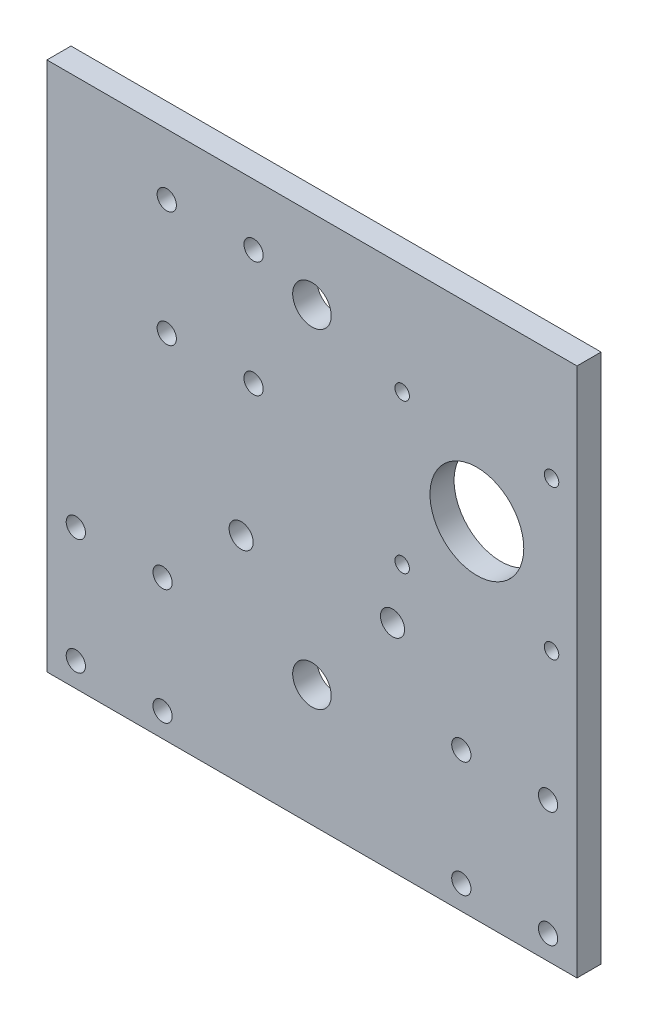
from build123d import *

# Parameters (mm, degrees)
SKETCH1_W           = 110
SKETCH1_H           = 110
SKETCH1_R           = 2
SKETCH1_R_2         = 9.730805131
SKETCH1_R_3         = 1.5
SKETCH1_R_4         = 4
SKETCH1_R_5         = 2.5
BOSS_EXTRUDE1_DEPTH = 5


with BuildPart() as part:
    # Sketch1 → Boss-Extrude1 (new body)
    with BuildSketch(Plane.XY):
        with Locations((0, -7.351163613)):
            Rectangle(SKETCH1_W, SKETCH1_H)
        with Locations((-31, -33.351163613)):
            Circle(SKETCH1_R, mode=Mode.SUBTRACT)
        with Locations((-49, -33.351163613)):
            Circle(SKETCH1_R, mode=Mode.SUBTRACT)
        with Locations((-49, -57.351163613)):
            Circle(SKETCH1_R, mode=Mode.SUBTRACT)
        with Locations((-31, -57.351163613)):
            Circle(SKETCH1_R, mode=Mode.SUBTRACT)
        with Locations((49, -33.351163613)):
            Circle(SKETCH1_R, mode=Mode.SUBTRACT)
        with Locations((31, -33.351163613)):
            Circle(SKETCH1_R, mode=Mode.SUBTRACT)
        with Locations((31, -57.351163613)):
            Circle(SKETCH1_R, mode=Mode.SUBTRACT)
        with Locations((49, -57.351163613)):
            Circle(SKETCH1_R, mode=Mode.SUBTRACT)
        with Locations((34.225747303, 9.328776995)):
            Circle(SKETCH1_R_2, mode=Mode.SUBTRACT)
        with Locations((49.725747303, 24.828776995)):
            Circle(SKETCH1_R_3, mode=Mode.SUBTRACT)
        with Locations((49.725747303, -6.171223005)):
            Circle(SKETCH1_R_3, mode=Mode.SUBTRACT)
        with Locations((18.725747303, -6.171223005)):
            Circle(SKETCH1_R_3, mode=Mode.SUBTRACT)
        with Locations((18.725747303, 24.828776995)):
            Circle(SKETCH1_R_3, mode=Mode.SUBTRACT)
        with Locations((0, 31.148836387)):
            Circle(SKETCH1_R_4, mode=Mode.SUBTRACT)
        with Locations((0, -37.151163613)):
            Circle(SKETCH1_R_4, mode=Mode.SUBTRACT)
        with Locations((-12.117054537, 34.957603341)):
            Circle(SKETCH1_R, mode=Mode.SUBTRACT)
        with Locations((-30.130204968, 34.957603341)):
            Circle(SKETCH1_R, mode=Mode.SUBTRACT)
        with Locations((-30.130204968, 10.940069433)):
            Circle(SKETCH1_R, mode=Mode.SUBTRACT)
        with Locations((-12.117054537, 10.940069433)):
            Circle(SKETCH1_R, mode=Mode.SUBTRACT)
        with Locations((16.720686105, -17.65636883)):
            Circle(SKETCH1_R_5, mode=Mode.SUBTRACT)
        with Locations((-14.692983623, -17.65636883)):
            Circle(SKETCH1_R_5, mode=Mode.SUBTRACT)
    extrude(amount=BOSS_EXTRUDE1_DEPTH)


solid = part.part
